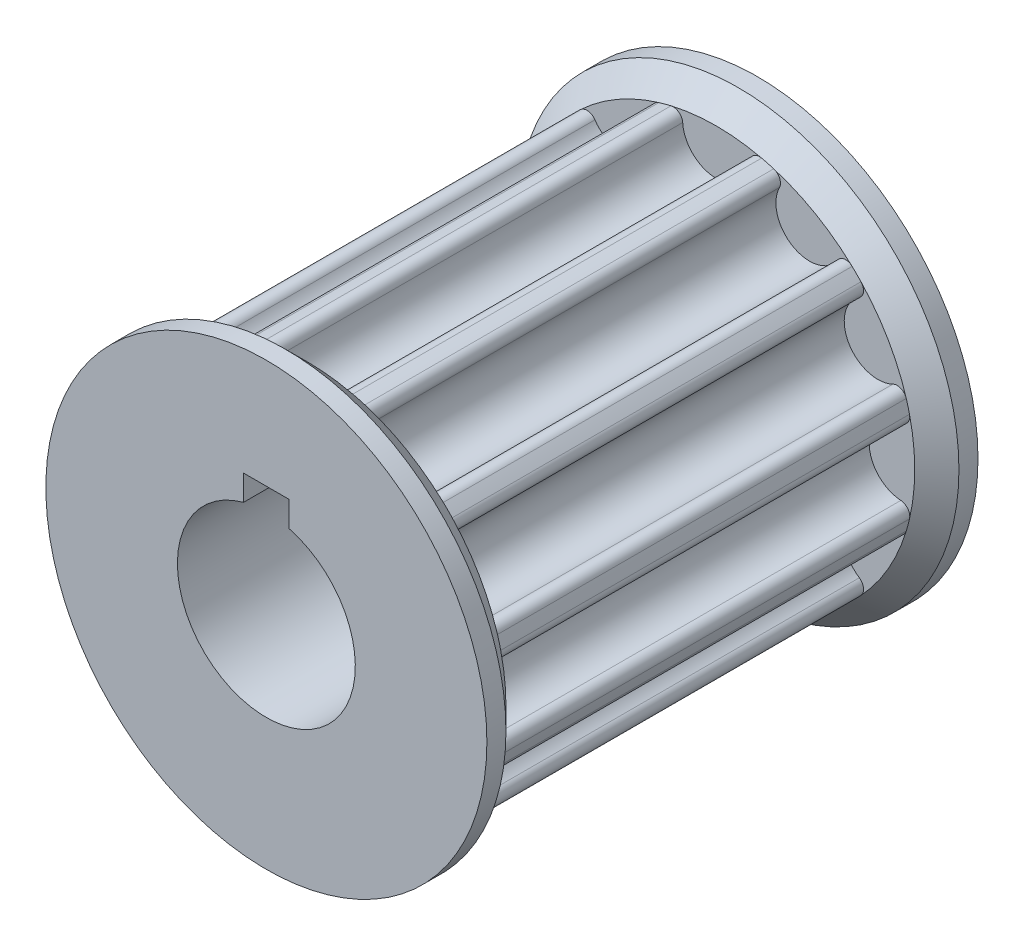
from build123d import *

# Parameters (mm, degrees)
SALIENTE_EXTRUIR1_DEPTH   = 9.25
CROQUIS5_R                = 8.98
SALIENTE_EXTRUIR2_DEPTH   = 1
SALIENTE_EXTRUIR2_DRAFT   = -45
CROQUIS8_R                = 9.98
SALIENTE_EXTRUIR3_DEPTH   = 0.86250003
SIMETR_A1_COPY_1_SKETCH_R = 8.98
SIMETR_A1_COPY_1_DEPTH    = 1
SIMETR_A1_COPY_1_DRAFT    = -45
CORTAR_EXTRUIR1_DEPTH     = 27.327769136


with BuildPart() as part:
    # Croquis3 → Saliente-Extruir1 (new, symmetric)
    with BuildSketch(Plane.XY):
        with BuildLine():
            ThreePointArc((0, 6.92), (1.044537818, 7.333889859), (1.522093853, 8.350897382))
            ThreePointArc((1.522093853, 8.350897382), (1.69468698, 8.669418435), (2.049408684, 8.74301573))
            ThreePointArc((2.049408684, 8.74301573), (2.324195025, 8.67401392), (2.596667882, 8.596378069))
            ThreePointArc((2.596667882, 8.596378069), (2.867067241, 8.355280091), (2.857276747, 7.993136203))
            ThreePointArc((2.857276747, 7.993136203), (2.762348644, 6.873603835), (3.46, 5.992895794))
            ThreePointArc((3.46, 5.992895794), (4.571541215, 5.829066017), (5.493620634, 6.47104235))
            ThreePointArc((5.493620634, 6.47104235), (5.802351194, 6.660593111), (6.146347848, 6.546969386))
            ThreePointArc((6.146347848, 6.546969386), (6.349818895, 6.349818895), (6.546969386, 6.146347848))
            ThreePointArc((6.546969386, 6.146347848), (6.660593111, 5.802351194), (6.47104235, 5.493620634))
            ThreePointArc((6.47104235, 5.493620634), (5.829066017, 4.571541215), (5.992895794, 3.46))
            ThreePointArc((5.992895794, 3.46), (6.873603835, 2.762348644), (7.993136203, 2.857276747))
            ThreePointArc((7.993136203, 2.857276747), (8.355280091, 2.867067241), (8.596378069, 2.596667882))
            ThreePointArc((8.596378069, 2.596667882), (8.67401392, 2.324195025), (8.74301573, 2.049408684))
            ThreePointArc((8.74301573, 2.049408684), (8.669418435, 1.69468698), (8.350897382, 1.522093853))
            ThreePointArc((8.350897382, 1.522093853), (7.333889859, 1.044537818), (6.92, 0))
            ThreePointArc((6.92, 0), (7.333889859, -1.044537818), (8.350897382, -1.522093853))
            ThreePointArc((8.350897382, -1.522093853), (8.669418435, -1.69468698), (8.74301573, -2.049408684))
            ThreePointArc((8.74301573, -2.049408684), (8.67401392, -2.324195025), (8.596378069, -2.596667882))
            ThreePointArc((8.596378069, -2.596667882), (8.355280091, -2.867067241), (7.993136203, -2.857276747))
            ThreePointArc((7.993136203, -2.857276747), (6.873603835, -2.762348644), (5.992895794, -3.46))
            ThreePointArc((5.992895794, -3.46), (5.829066017, -4.571541215), (6.47104235, -5.493620634))
            ThreePointArc((6.47104235, -5.493620634), (6.660593111, -5.802351194), (6.546969386, -6.146347848))
            ThreePointArc((6.546969386, -6.146347848), (6.349818895, -6.349818895), (6.146347848, -6.546969386))
            ThreePointArc((6.146347848, -6.546969386), (5.802351194, -6.660593111), (5.493620634, -6.47104235))
            ThreePointArc((5.493620634, -6.47104235), (4.571541215, -5.829066017), (3.46, -5.992895794))
            ThreePointArc((3.46, -5.992895794), (2.762348644, -6.873603835), (2.857276747, -7.993136203))
            ThreePointArc((2.857276747, -7.993136203), (2.867067241, -8.355280091), (2.596667882, -8.596378069))
            ThreePointArc((2.596667882, -8.596378069), (2.324195025, -8.67401392), (2.049408684, -8.74301573))
            ThreePointArc((2.049408684, -8.74301573), (1.69468698, -8.669418435), (1.522093853, -8.350897382))
            ThreePointArc((1.522093853, -8.350897382), (1.044537818, -7.333889859), (0, -6.92))
            ThreePointArc((0, -6.92), (-1.044537818, -7.333889859), (-1.522093853, -8.350897382))
            ThreePointArc((-1.522093853, -8.350897382), (-1.69468698, -8.669418435), (-2.049408684, -8.74301573))
            ThreePointArc((-2.049408684, -8.74301573), (-2.324195025, -8.67401392), (-2.596667882, -8.596378069))
            ThreePointArc((-2.596667882, -8.596378069), (-2.867067241, -8.355280091), (-2.857276747, -7.993136203))
            ThreePointArc((-2.857276747, -7.993136203), (-2.762348644, -6.873603835), (-3.46, -5.992895794))
            ThreePointArc((-3.46, -5.992895794), (-4.571541215, -5.829066017), (-5.493620634, -6.47104235))
            ThreePointArc((-5.493620634, -6.47104235), (-5.802351194, -6.660593111), (-6.146347848, -6.546969386))
            ThreePointArc((-6.146347848, -6.546969386), (-6.349818895, -6.349818895), (-6.546969386, -6.146347848))
            ThreePointArc((-6.546969386, -6.146347848), (-6.660593111, -5.802351194), (-6.47104235, -5.493620634))
            ThreePointArc((-6.47104235, -5.493620634), (-5.829066017, -4.571541215), (-5.992895794, -3.46))
            ThreePointArc((-5.992895794, -3.46), (-6.873603835, -2.762348644), (-7.993136203, -2.857276747))
            ThreePointArc((-7.993136203, -2.857276747), (-8.355280091, -2.867067241), (-8.596378069, -2.596667882))
            ThreePointArc((-8.596378069, -2.596667882), (-8.67401392, -2.324195025), (-8.74301573, -2.049408684))
            ThreePointArc((-8.74301573, -2.049408684), (-8.669418435, -1.69468698), (-8.350897382, -1.522093853))
            ThreePointArc((-8.350897382, -1.522093853), (-7.333889859, -1.044537818), (-6.92, 0))
            ThreePointArc((-6.92, 0), (-7.333889859, 1.044537818), (-8.350897382, 1.522093853))
            ThreePointArc((-8.350897382, 1.522093853), (-8.669418435, 1.69468698), (-8.74301573, 2.049408684))
            ThreePointArc((-8.74301573, 2.049408684), (-8.67401392, 2.324195025), (-8.596378069, 2.596667882))
            ThreePointArc((-8.596378069, 2.596667882), (-8.355280091, 2.867067241), (-7.993136203, 2.857276747))
            ThreePointArc((-7.993136203, 2.857276747), (-6.873603835, 2.762348644), (-5.992895794, 3.46))
            ThreePointArc((-5.992895794, 3.46), (-5.829066017, 4.571541215), (-6.47104235, 5.493620634))
            ThreePointArc((-6.47104235, 5.493620634), (-6.660593111, 5.802351194), (-6.546969386, 6.146347848))
            ThreePointArc((-6.546969386, 6.146347848), (-6.349818895, 6.349818895), (-6.146347848, 6.546969386))
            ThreePointArc((-6.146347848, 6.546969386), (-5.802351194, 6.660593111), (-5.493620634, 6.47104235))
            ThreePointArc((-5.493620634, 6.47104235), (-4.571541215, 5.829066017), (-3.46, 5.992895794))
            ThreePointArc((-3.46, 5.992895794), (-2.762348644, 6.873603835), (-2.857276747, 7.993136203))
            ThreePointArc((-2.857276747, 7.993136203), (-2.867067241, 8.355280091), (-2.596667882, 8.596378069))
            ThreePointArc((-2.596667882, 8.596378069), (-2.324195025, 8.67401392), (-2.049408684, 8.74301573))
            ThreePointArc((-2.049408684, 8.74301573), (-1.69468698, 8.669418435), (-1.522093853, 8.350897382))
            ThreePointArc((-1.522093853, 8.350897382), (-1.044537818, 7.333889859), (0, 6.92))
        make_face()
    extrude(amount=SALIENTE_EXTRUIR1_DEPTH, both=True)


with BuildPart() as saliente_extruir2_tool:
    # Croquis5 → Saliente-Extruir2 (with draft: the straight prism first)
    with BuildSketch(Plane.XY.offset(9.25)):
        Circle(CROQUIS5_R)
    extrude(amount=SALIENTE_EXTRUIR2_DEPTH)
    # Saliente-Extruir2: the draft: its side faces are tilted about the plane it starts from
    saliente_extruir2_sides = [saliente_extruir2_tool.faces().sort_by_distance(p)[0] for p in [
        (-8.98, 0, 9.75),
    ]]
    draft(saliente_extruir2_sides, Plane.XY.offset(9.25), SALIENTE_EXTRUIR2_DRAFT)


with BuildPart() as part_1:
    add(part.part)

    # Saliente-Extruir2: add saliente_extruir2_tool
    add(saliente_extruir2_tool.part)

    # Croquis8 → Saliente-Extruir3 (add)
    with BuildSketch(Plane.XY.offset(10.25)):
        Circle(CROQUIS8_R)
    saliente_extruir3 = extrude(amount=SALIENTE_EXTRUIR3_DEPTH)


with BuildPart() as simetr_a1_1:
    # Simetría1: Saliente-Extruir3 across plane
    add(saliente_extruir3.mirror(Plane.XY))


with BuildPart() as simetr_a1_copy_1_tool:
    # Simetría1 copy 1 sketch → Simetría1 copy 1 (with draft: the straight prism first)
    with BuildSketch(Plane(origin=(0, 0, -9.25), x_dir=(1, 0, 0), z_dir=(0, 0, -1))):
        Circle(SIMETR_A1_COPY_1_SKETCH_R)
    extrude(amount=SIMETR_A1_COPY_1_DEPTH)
    # Simetría1 copy 1: the draft: its side faces are tilted about the plane it starts from
    simetr_a1_copy_1_sides = [simetr_a1_copy_1_tool.faces().sort_by_distance(p)[0] for p in [
        (-8.98, 0, -9.75),
    ]]
    draft(simetr_a1_copy_1_sides, Plane(origin=(0, 0, -9.25), x_dir=(1, 0, 0), z_dir=(0, 0, -1)), SIMETR_A1_COPY_1_DRAFT)


with BuildPart() as part_2:
    add(part_1.part)

    # Simetría1 copy 1: add simetr_a1_copy_1_tool
    add(simetr_a1_copy_1_tool.part)

    add(simetr_a1_1.part)  # Simetría1 copy 1 merges Simetría1_1

    # Croquis6 → Cortar-Extruir1 (cut, through all)
    with BuildSketch(Plane.XY.offset(11.11250003)):
        with BuildLine():
            Line((-1.035, 3.889652941), (-1.035, 5.04))
            Line((-1.035, 5.04), (1.035, 5.04))
            Line((1.035, 5.04), (1.035, 3.889652941))
            ThreePointArc((1.035, 3.889652941), (0, -4.025), (-1.035, 3.889652941))
        make_face()
    extrude(amount=-CORTAR_EXTRUIR1_DEPTH, mode=Mode.SUBTRACT)


solid = part_2.part
